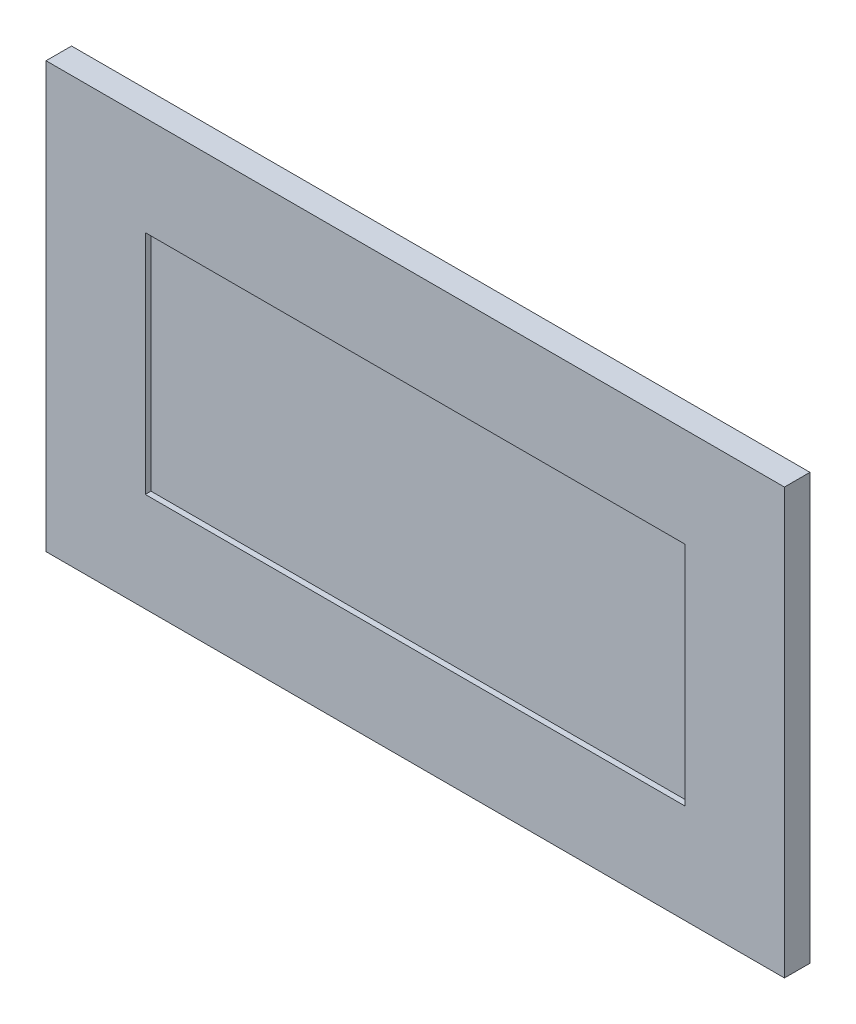
from build123d import *

# Parameters (mm, degrees)
SKETCH1_W           = 521
SKETCH1_H           = 300
BOSS_EXTRUDE1_DEPTH = 18
SKETCH2_W           = 381
SKETCH2_H           = 160
CUT_EXTRUDE1_DEPTH  = 4


with BuildPart() as part:
    # Sketch1 → Boss-Extrude1 (new body)
    with BuildSketch(Plane.XY):
        Rectangle(SKETCH1_W, SKETCH1_H)
    extrude(amount=BOSS_EXTRUDE1_DEPTH)

    # Sketch2 → Cut-Extrude1 (cut)
    with BuildSketch(Plane.XY.offset(18)):
        Rectangle(SKETCH2_W, SKETCH2_H)
    extrude(amount=-CUT_EXTRUDE1_DEPTH, mode=Mode.SUBTRACT)


solid = part.part
